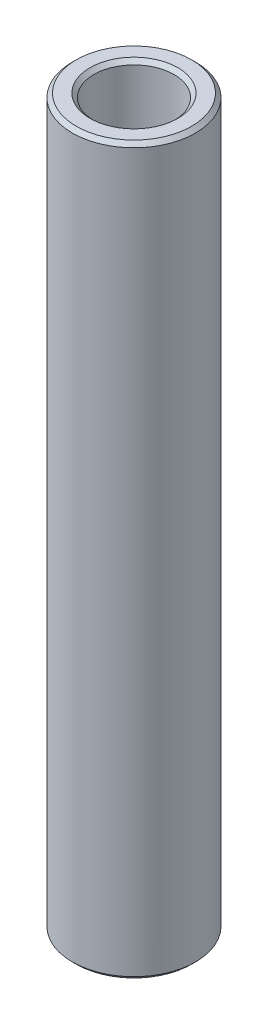
from build123d import *

# Parameters (mm, degrees)
SKETCH1_W     = 0.7
SKETCH1_H     = 23.57374
CHAMFER1_SIZE = 0.127


with BuildPart() as part:
    # Sketch1 → Revolve1 (revolve)
    with BuildSketch(Plane.XY, mode=Mode.PRIVATE) as revolve1_sk:
        with Locations((1.65, 0)):
            Rectangle(SKETCH1_W, SKETCH1_H)
    revolve(revolve1_sk.sketch.rotate(Axis((0, 9.615558323, 0), (0, -1, 0)), 90), axis=Axis((0, 9.615558323, 0), (0, -1, 0)))

    # Chamfer1
    chamfer1_edges = [part.edges().sort_by_distance(p)[0] for p in [
        (0, 11.78687, -1.3),
        (0, 11.78687, -2),
        (0, -11.78687, -2),
        (0, -11.78687, -1.3),
    ]]
    chamfer(chamfer1_edges, length=CHAMFER1_SIZE)


solid = part.part
